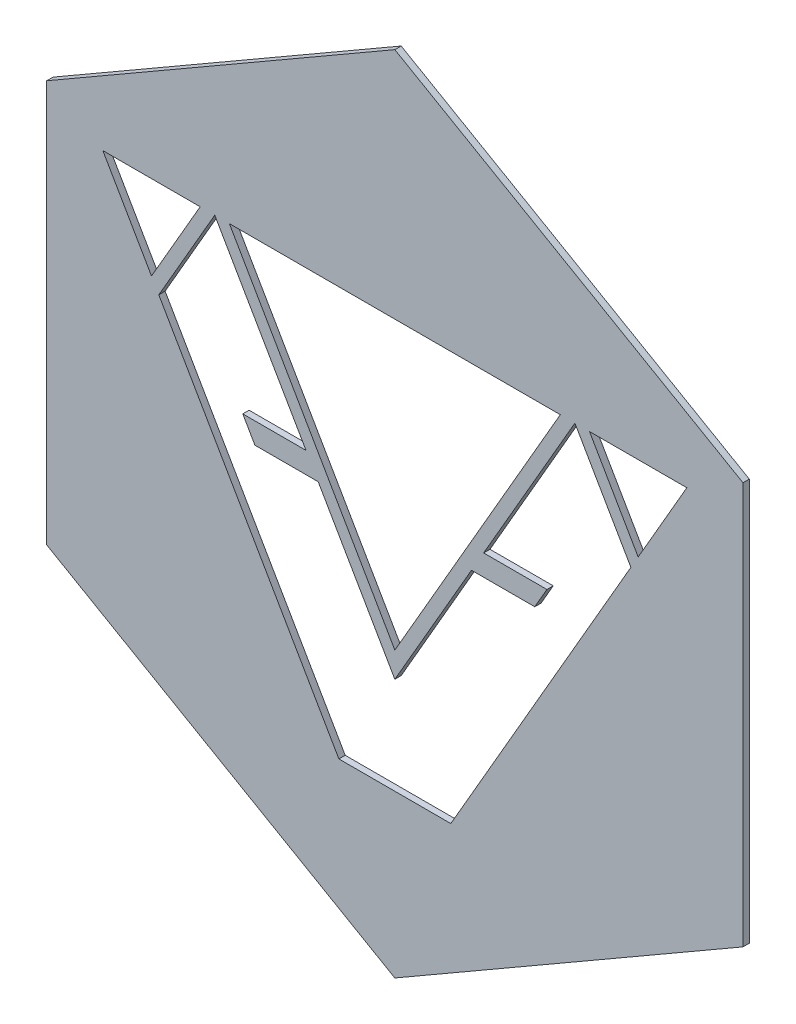
from build123d import *

# Parameters (mm, degrees)
BOSS_EXTRUDE1_DEPTH = 0.5


with BuildPart() as part:
    # Sketch1 → Boss-Extrude1 (new body)
    with BuildSketch(Plane.XY):
        Polygon((27.53269207, 15.896007178), (0, 31.792014357), (-27.53269207, 15.896007178), (-27.53269207, -15.896007178), (0, -31.792014357), (27.53269207, -15.896007178), align=None)
        Polygon((23.094010768, 13.333333333), (15.396007178, 13.333333333), (19.245008973, 6.666666667), align=None, mode=Mode.SUBTRACT)
        Polygon((4.426352064, -19), (18.667658704, 5.666666667), (14.24130664, 13.333333333), (7.024428275, 0.833333333), (12.028130608, 0.833333333), (11.065880159, -0.833333333), (6.062177826, -0.833333333), (0, -11.333333333), (-6.062177826, -0.833333333), (-11.065880159, -0.833333333), (-12.028130608, 0.833333333), (-7.024428275, 0.833333333), (-14.24130664, 13.333333333), (-18.667658704, 5.666666667), (-4.426352064, -19), align=None, mode=Mode.SUBTRACT)
        Polygon((0, -9.333333333), (13.086606102, 13.333333333), (-13.086606102, 13.333333333), align=None, mode=Mode.SUBTRACT)
        Polygon((-23.094010768, 13.333333333), (-19.245008973, 6.666666667), (-15.396007178, 13.333333333), align=None, mode=Mode.SUBTRACT)
    extrude(amount=BOSS_EXTRUDE1_DEPTH)


solid = part.part
